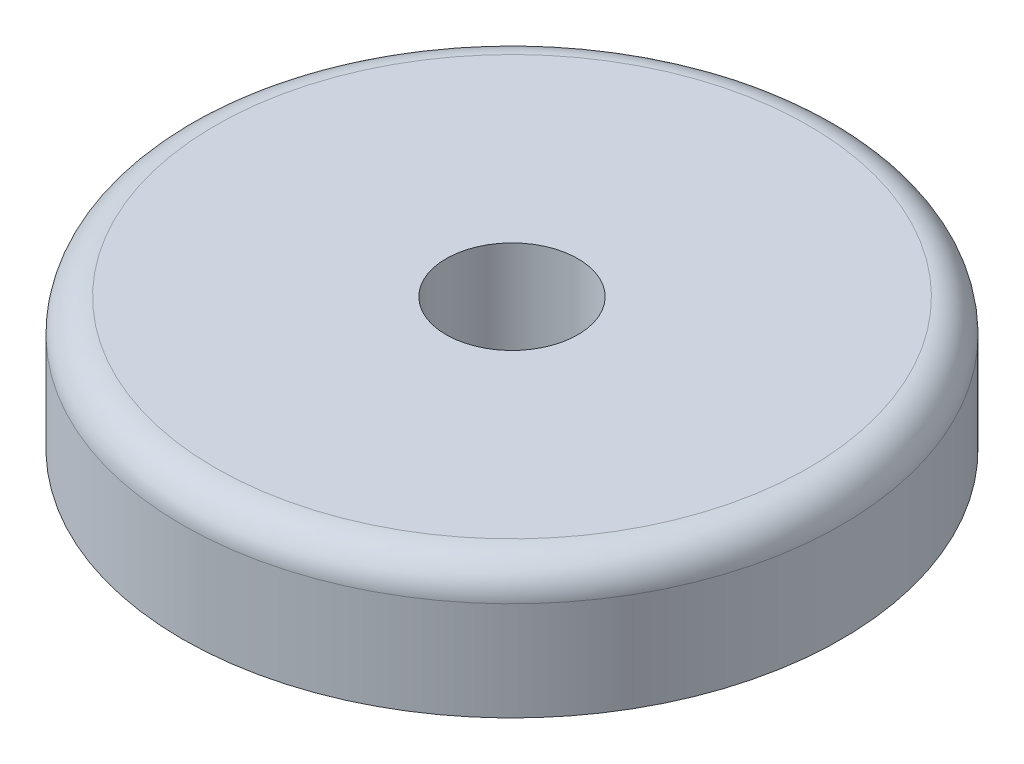
from build123d import *

# Parameters (mm, degrees)
SKETCH1_R           = 5
BOSS_EXTRUDE1_DEPTH = 2
SKETCH2_R           = 1
CUT_EXTRUDE1_DEPTH  = 12.5
FILLET1_R           = 0.5


with BuildPart() as part:
    # Sketch1 → Boss-Extrude1 (new body)
    with BuildSketch(Plane(origin=(0, 0, 0), x_dir=(1, 0, 0), z_dir=(0, 1, 0))):
        with Locations(Location((0, 0, 0), (0, 0, 270))):
            Circle(SKETCH1_R)
    extrude(amount=BOSS_EXTRUDE1_DEPTH)

    # Sketch2 → Cut-Extrude1 (cut)
    with BuildSketch(Plane(origin=(0, 2, 0), x_dir=(1, 0, 0), z_dir=(0, 1, 0))):
        with Locations(Location((0, 0, 0), (0, 0, 270))):
            Circle(SKETCH2_R)
    extrude(amount=-CUT_EXTRUDE1_DEPTH, mode=Mode.SUBTRACT)

    # Fillet1
    fillet1_edges = [part.edges().sort_by_distance(p)[0] for p in [
        (0, 2, -5),
    ]]
    fillet(fillet1_edges, radius=FILLET1_R)


solid = part.part
